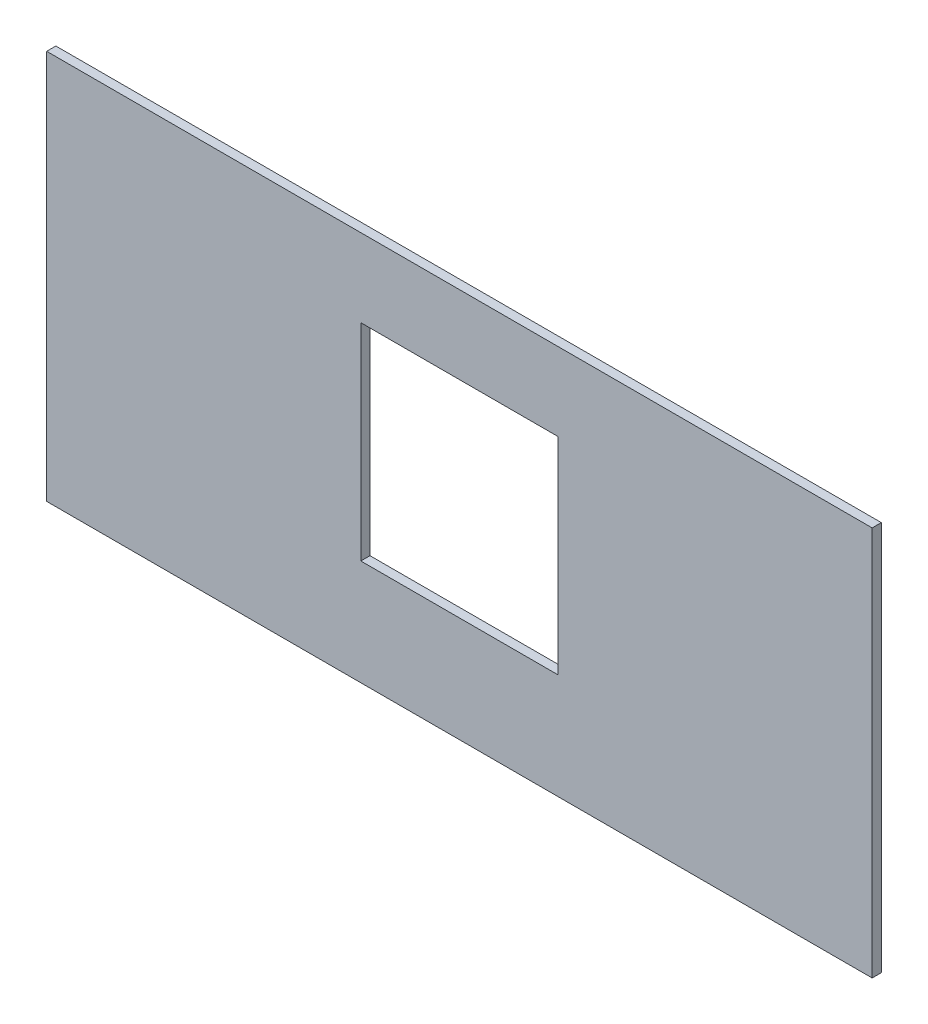
from build123d import *

# Parameters (mm, degrees)
SKETCH1_W           = 180
SKETCH1_H           = 85
BOSS_EXTRUDE1_DEPTH = 2
SKETCH2_W           = 43
SKETCH2_H           = 45
CUT_EXTRUDE1_DEPTH  = 50.8


with BuildPart() as part:
    # Sketch1 → Boss-Extrude1 (new body)
    with BuildSketch(Plane.XY):
        with Locations((90, -42.5)):
            Rectangle(SKETCH1_W, SKETCH1_H)
    extrude(amount=BOSS_EXTRUDE1_DEPTH)

    # Sketch2 → Cut-Extrude1 (cut)
    with BuildSketch(Plane.XY.offset(2)):
        with Locations((90, -39.5)):
            Rectangle(SKETCH2_W, SKETCH2_H)
    extrude(amount=-CUT_EXTRUDE1_DEPTH, mode=Mode.SUBTRACT)


solid = part.part
